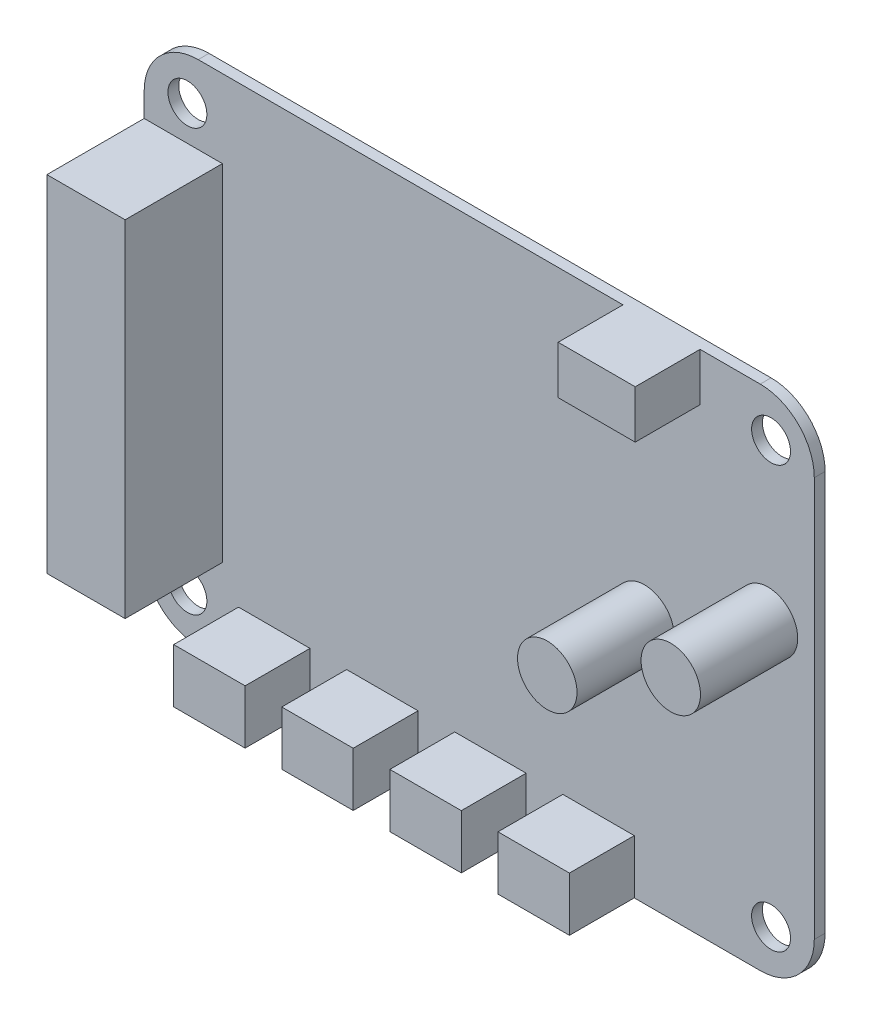
from build123d import *

# Parameters (mm, degrees)
SKETCH_2_R      = 1.8
EXTRUDE_1_DEPTH = 1
SKETCH_4_W      = 7.237291628
SKETCH_4_H      = 31.958994792
EXTRUDE_2_DEPTH = 9
SKETCH_5_W      = 6.609648953
SKETCH_5_H      = 4.992409467
SKETCH_5_W_2    = 7.131463344
SKETCH_5_H_2    = 4.436954379
EXTRUDE_3_DEPTH = 6
SKETCH_6_R      = 2.75
EXTRUDE_4_DEPTH = 9
SKETCH_7_W      = 5
SKETCH_7_H      = 28.854406725
EXTRUDE_5_DEPTH = 0.4


with BuildPart() as part:
    # 草图2 → 凸台-拉伸1 (new body)
    with BuildSketch(Plane.XY):
        with BuildLine():
            Line((-26, 23.5), (26, 23.5))
            ThreePointArc((26, 23.5), (29.535533906, 22.035533906), (31, 18.5))
            Line((31, 18.5), (31, -18.5))
            ThreePointArc((31, -18.5), (29.535533906, -22.035533906), (26, -23.5))
            Line((26, -23.5), (-26, -23.5))
            ThreePointArc((-26, -23.5), (-29.535533906, -22.035533906), (-31, -18.5))
            Line((-31, -18.5), (-31, 18.5))
            ThreePointArc((-31, 18.5), (-29.535533906, 22.035533906), (-26, 23.5))
        make_face()
        with Locations((27, 19.5)):
            Circle(SKETCH_2_R, mode=Mode.SUBTRACT)
        with Locations(Location((-27, 19.5, 0), (0, 0, 180))):
            Circle(SKETCH_2_R, mode=Mode.SUBTRACT)
        with Locations(Location((27, -19.5, 0), (0, 0, 180))):
            Circle(SKETCH_2_R, mode=Mode.SUBTRACT)
        with Locations((-27, -19.5)):
            Circle(SKETCH_2_R, mode=Mode.SUBTRACT)
    extrude(amount=EXTRUDE_1_DEPTH)

    # 草图4 → 凸台-拉伸2 (add)
    with BuildSketch(Plane.XY.offset(1)):
        with Locations((-27.381354186, 0.304371379)):
            Rectangle(SKETCH_4_W, SKETCH_4_H)
    extrude(amount=EXTRUDE_2_DEPTH)

    # 草图5 → 凸台-拉伸3 (add)
    with BuildSketch(Plane.XY.offset(1)):
        with Locations((-18.965120236, -21.003795266)):
            Rectangle(SKETCH_5_W, SKETCH_5_H)
        with Locations((-8.96367774, -21.003795266)):
            Rectangle(SKETCH_5_W, SKETCH_5_H)
        with Locations((1.037764754, -21.003795266)):
            Rectangle(SKETCH_5_W, SKETCH_5_H)
        with Locations((11.039207249, -21.003795266)):
            Rectangle(SKETCH_5_W, SKETCH_5_H)
        with Locations((16.866134615, 21.281522811)):
            Rectangle(SKETCH_5_W_2, SKETCH_5_H_2)
    extrude(amount=EXTRUDE_3_DEPTH)

    # 草图6 → 凸台-拉伸4 (add)
    with BuildSketch(Plane.XY.offset(1)):
        with Locations((26.719458911, 4.848201251)):
            Circle(SKETCH_6_R)
        with Locations((15.293444682, -0.687190124)):
            Circle(SKETCH_6_R)
    extrude(amount=EXTRUDE_4_DEPTH)

    # 草图7 → 凸台-拉伸5 (add)
    with BuildSketch(Plane(origin=(0, 0, 0), x_dir=(-1, 0, 0), z_dir=(0, 0, -1))):
        with Locations((28.5, -0.417423606)):
            Rectangle(SKETCH_7_W, SKETCH_7_H)
    extrude(amount=EXTRUDE_5_DEPTH)


solid = part.part
